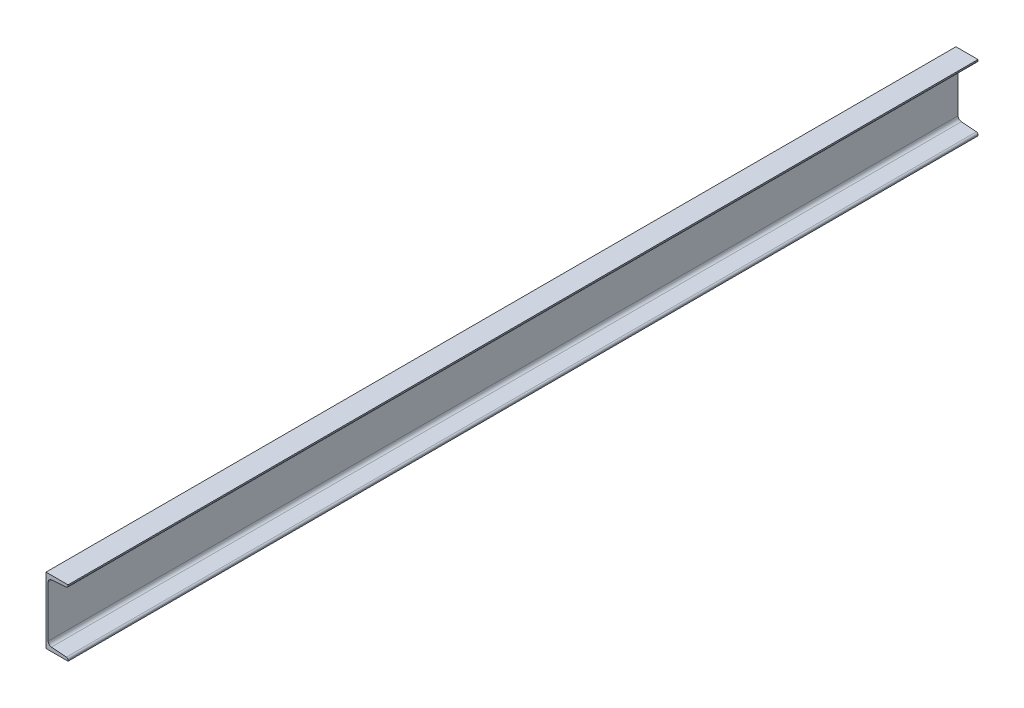
from build123d import *

# Parameters (mm, degrees)
BOSS_EXTRUDE1_DEPTH = 4125


with BuildPart() as part:
    # Model → Boss-Extrude1 (new body)
    with BuildSketch(Plane.XY):
        with BuildLine():
            Line((5066.585444571, 3271.479764732), (5066.585444571, 3266.91403211))
            ThreePointArc((5066.585444571, 3266.91403211), (5064.466604824, 3261.490753205), (5059.232456051, 3258.940239026))
            Line((5059.232456051, 3258.940239026), (4991.291421612, 3253.427350899))
            ThreePointArc((4991.291421612, 3253.427350899), (4980.823124065, 3248.326322542), (4976.585444571, 3237.479764732))
            Line((4976.585444571, 3237.479764732), (4976.585444571, 3005.479764732))
            ThreePointArc((4976.585444571, 3005.479764732), (4980.823124065, 2994.633206922), (4991.291421612, 2989.532178564))
            Line((4991.291421612, 2989.532178564), (5059.232456051, 2984.019290437))
            ThreePointArc((5059.232456051, 2984.019290437), (5064.466604824, 2981.468776258), (5066.585444571, 2976.045497353))
            Line((5066.585444571, 2976.045497353), (5066.585444571, 2971.479764732))
            Line((5066.585444571, 2971.479764732), (4966.585444571, 2971.479764732))
            Line((4966.585444571, 2971.479764732), (4966.585444571, 3271.479764732))
            Line((4966.585444571, 3271.479764732), (5066.585444571, 3271.479764732))
        make_face()
    extrude(amount=BOSS_EXTRUDE1_DEPTH)


solid = part.part
